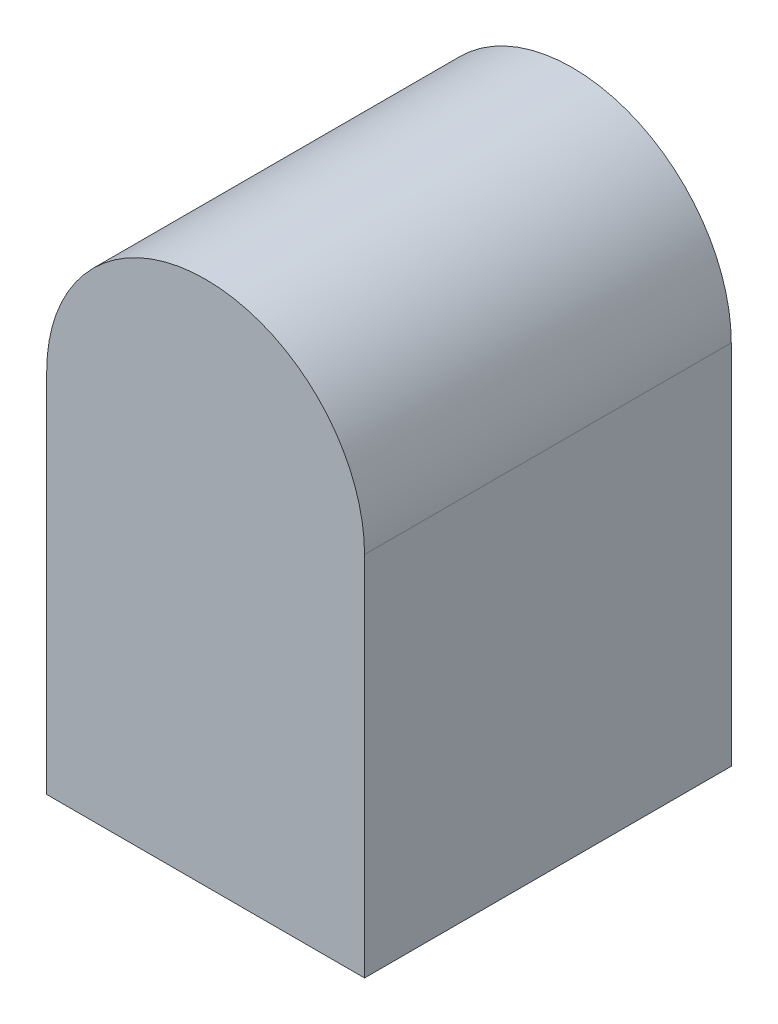
from build123d import *

# Parameters (mm, degrees)
BOSS_EXTRUDE1_DEPTH = 30
SKETCH2_R           = 2.5
BOSS_EXTRUDE2_DEPTH = 10


with BuildPart() as part:
    # Sketch1 → Boss-Extrude1 (new body)
    with BuildSketch(Plane.XY):
        with BuildLine():
            Line((0, 0), (0, -30))
            Line((0, -30), (26, -30))
            Line((26, -30), (26, 0))
            ThreePointArc((26, 0), (13, 13), (0, 0))
        make_face()
    extrude(amount=BOSS_EXTRUDE1_DEPTH)

    # Sketch2 → Boss-Extrude2 (add)
    with BuildSketch(Plane(origin=(0, 0, 0), x_dir=(-1, 0, 0), z_dir=(0, 0, -1))):
        with Locations(Location((-13, -10, 0), (0, 0, 180))):
            Circle(SKETCH2_R)
    extrude(amount=BOSS_EXTRUDE2_DEPTH)


solid = part.part
